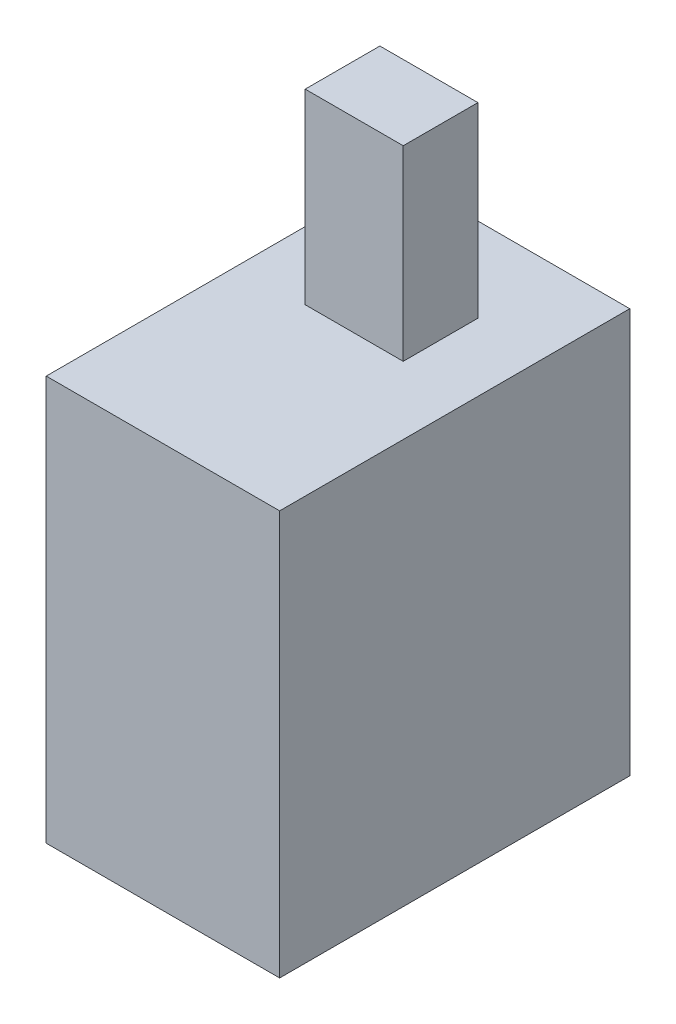
from build123d import *

# Parameters (mm, degrees)
CROQUIS1_W              = 15
CROQUIS1_H              = 22.5
SALIENTE_EXTRUIR1_DEPTH = 26
CROQUIS2_W              = 6.3
CROQUIS2_H              = 4.8
SALIENTE_EXTRUIR2_DEPTH = 12


with BuildPart() as part:
    # Croquis1 → Saliente-Extruir1 (new body)
    with BuildSketch(Plane(origin=(0, 0, 0), x_dir=(1, 0, 0), z_dir=(0, 1, 0))):
        with Locations((7.5, 11.25)):
            Rectangle(CROQUIS1_W, CROQUIS1_H)
    extrude(amount=SALIENTE_EXTRUIR1_DEPTH)

    # Croquis2 → Saliente-Extruir2 (add)
    with BuildSketch(Plane(origin=(0, 26, 0), x_dir=(1, 0, 0), z_dir=(0, 1, 0))):
        with Locations((7.5, 14.691559925)):
            Rectangle(CROQUIS2_W, CROQUIS2_H)
    extrude(amount=SALIENTE_EXTRUIR2_DEPTH)


solid = part.part
